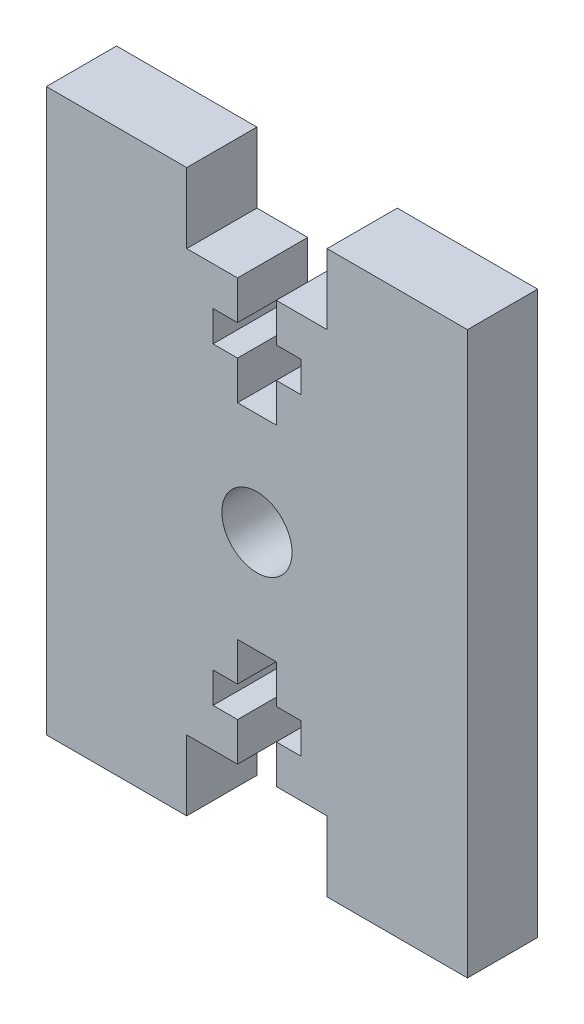
from build123d import *

# Parameters (mm, degrees)
BOSS_EXTRUDE1_DEPTH = 6.35
SKETCH3_R           = 3.175
CUT_EXTRUDE1_DEPTH  = 33.378773911


with BuildPart() as part:
    # Sketch2 → Boss-Extrude1 (new body)
    with BuildSketch(Plane.XY):
        Polygon((-19.05, 0), (-19.05, 25.4), (-6.35, 25.4), (-6.35, 19.05), (-1.7526, 19.05), (-1.7526, 15.5495625), (-3.96875, 15.5495625), (-3.96875, 12.7714375), (-1.7526, 12.7714375), (-1.7526, 9.271), (1.7526, 9.271), (1.7526, 12.7714375), (3.96875, 12.7714375), (3.96875, 15.5495625), (1.7526, 15.5495625), (1.7526, 19.05), (6.35, 19.05), (6.35, 25.4), (19.05, 25.4), (19.05, 0), align=None)
    boss_extrude1 = extrude(amount=BOSS_EXTRUDE1_DEPTH)

    # Mirror1: Boss-Extrude1 across plane
    add(boss_extrude1.mirror(Plane(origin=(-19.05, 0, 6.35), x_dir=(0, 0, 1), z_dir=(0, 1, 0))))

    # Sketch3 → Cut-Extrude1 (cut, through all)
    with BuildSketch(Plane.XY.offset(6.35)):
        Circle(SKETCH3_R)
    extrude(amount=-CUT_EXTRUDE1_DEPTH, mode=Mode.SUBTRACT)


solid = part.part
